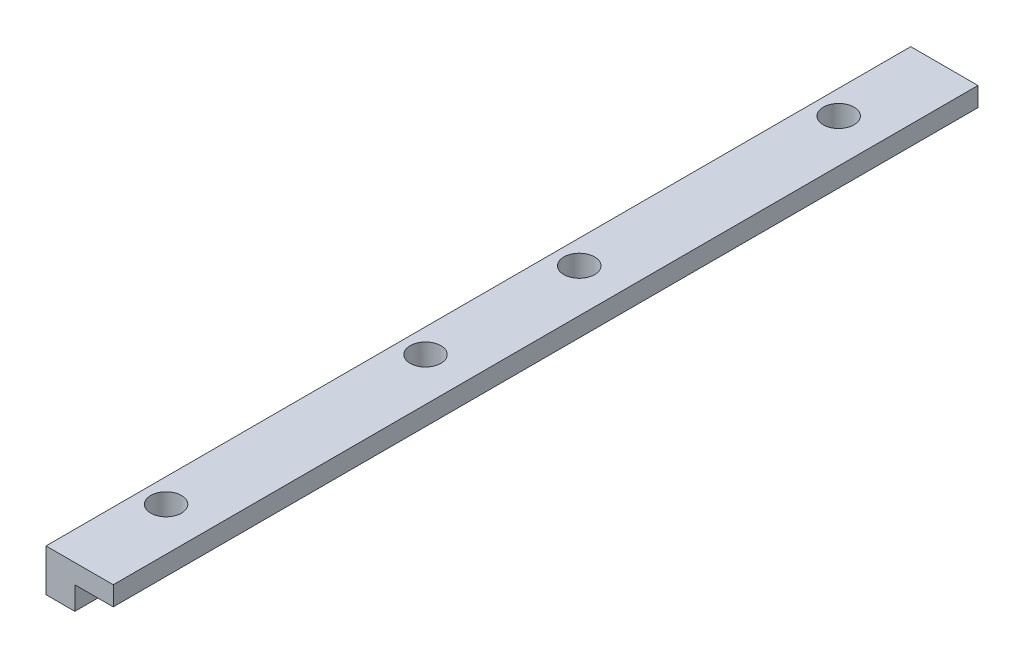
from build123d import *

# Parameters (mm, degrees)
EXTRUDE_1_DEPTH     = 90
SKETCH_2_R          = 1.6
CUT_EXTRUDE_1_DEPTH = 91.378979857


with BuildPart() as part:
    # 草图1 → 凸台-拉伸1 (new body)
    with BuildSketch(Plane.XY):
        Polygon((3, 0), (3, 2.4), (7, 2.4), (7, 4.4), (0, 4.4), (0, 0), align=None)
    extrude(amount=EXTRUDE_1_DEPTH)

    # 草图2 → 切除-拉伸1 (cut, through all)
    with BuildSketch(Plane(origin=(0, 4.4, 0), x_dir=(1, 0, 0), z_dir=(0, 1, 0))):
        with Locations(Location((2.5, -37, 0), (0, 0, 270))):
            Circle(SKETCH_2_R)
        with Locations(Location((2.5, -10, 0), (0, 0, 270))):
            Circle(SKETCH_2_R)
        with Locations(Location((2.5, -80, 0), (0, 0, 288.209956864))):
            Circle(SKETCH_2_R)
        with Locations(Location((2.5, -53, 0), (0, 0, 288.209956864))):
            Circle(SKETCH_2_R)
    extrude(amount=-CUT_EXTRUDE_1_DEPTH, mode=Mode.SUBTRACT)


solid = part.part
